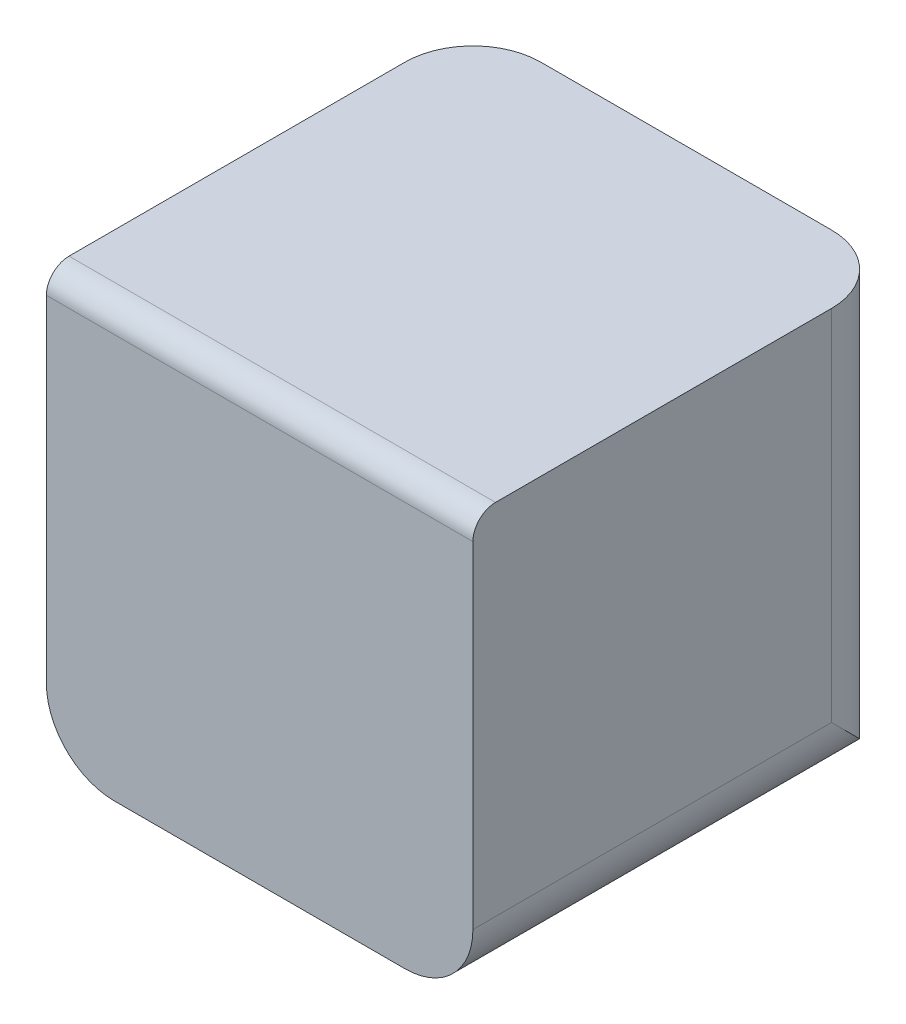
from build123d import *

# Parameters (mm, degrees)
SKETCH_1_W      = 18.84
SKETCH_1_H      = 18.84
EXTRUDE_1_DEPTH = 18.84
FILLET_1_R      = 1
FILLET_2_R      = 3


with BuildPart() as part:
    # 草图1 → 凸台-拉伸1 (new body)
    with BuildSketch(Plane(origin=(0, 0, 0), x_dir=(1, 0, 0), z_dir=(0, 1, 0))):
        Rectangle(SKETCH_1_W, SKETCH_1_H)
    extrude(amount=EXTRUDE_1_DEPTH)

    # 圆角1
    fillet_1_edges = [part.edges().sort_by_distance(p)[0] for p in [
        (0, 18.84, 9.42),
    ]]
    fillet(fillet_1_edges, radius=FILLET_1_R)

    # 圆角2
    fillet_2_edges = [part.edges().sort_by_distance(p)[0] for p in [
        (-9.42, 0, 0),
        (9.42, 0, 0),
        (-9.42, 9.42, -9.42),
        (9.42, 9.42, -9.42),
    ]]
    fillet(fillet_2_edges, radius=FILLET_2_R)


solid = part.part
